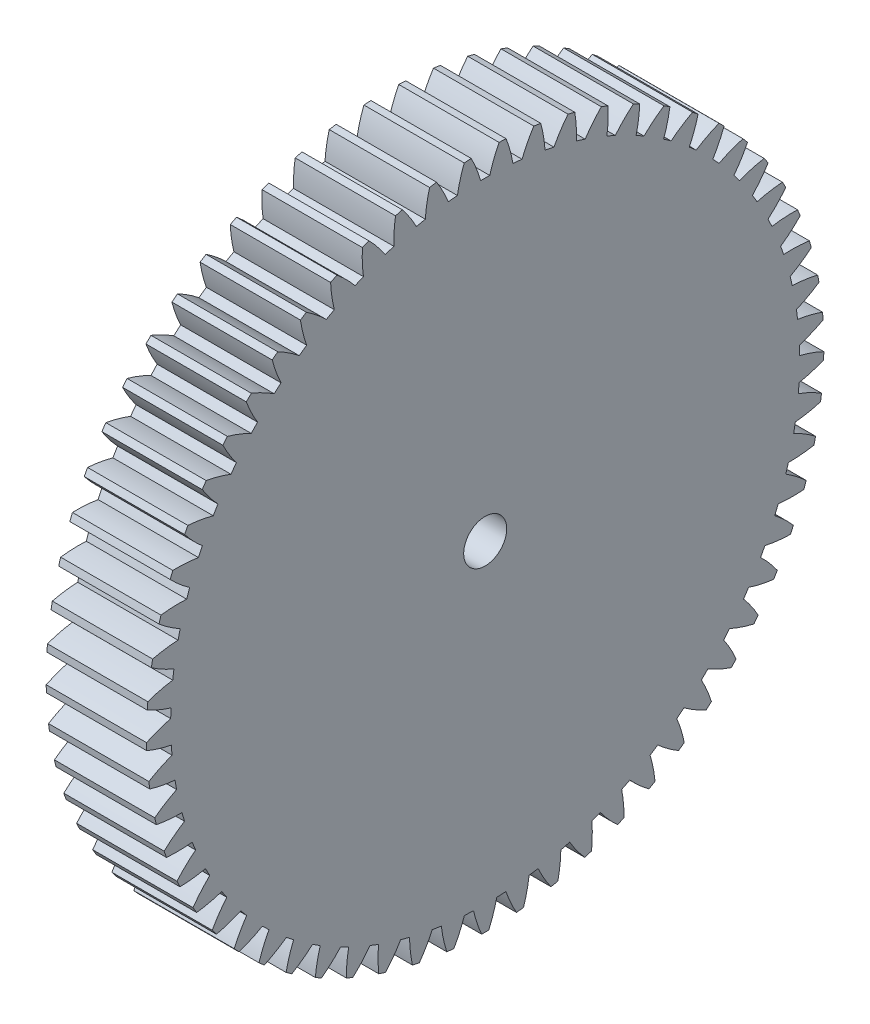
from build123d import *

# Parameters (mm, degrees)
BASPROSKE_W     = 14
BASPROSKE_H     = 47.25
TOOTHCUT_DEPTH  = 69.272432211
TEETHCUTS_COUNT = 61
TEETHCUTS_ANGLE = 354.098360656
BORSKE_R        = 3
BORE_DEPTH      = 50.0000508


with BuildPart() as part:
    # BasProSke → Base-Revolve (revolve)
    with BuildSketch(Plane(origin=(0, 0, 0), x_dir=(1, 0, 0), z_dir=(0, 1, 0)), mode=Mode.PRIVATE) as base_revolve_sk:
        with Locations((7, 23.625)):
            Rectangle(BASPROSKE_W, BASPROSKE_H)
    revolve(base_revolve_sk.sketch.rotate(Axis((-10, 0, 0), (1, 0, 0)), 180), axis=Axis((-10, 0, 0), (1, 0, 0)))

    # TooCutSke → ToothCut (cut, through all)
    with BuildSketch(Plane(origin=(0, 0, 0), x_dir=(0, 0, -1), z_dir=(1, 0, 0))):
        with BuildLine():
            ThreePointArc((0.637720624, 43.869365033), (0, 43.874), (-0.637720624, 43.869365033))
            ThreePointArc((-0.637720624, 43.869365033), (-1.212275139, 45.584750655), (-1.953389755, 47.235026343))
            ThreePointArc((-1.953389755, 47.235026343), (0, 47.2754), (1.953389755, 47.235026343))
            ThreePointArc((1.953389755, 47.235026343), (1.212275139, 45.584750655), (0.637720624, 43.869365033))
        make_face()
    toothcut = extrude(amount=TOOTHCUT_DEPTH, mode=Mode.SUBTRACT)

    # TeethCuts: ToothCut ×61 about axis
    teethcuts_axis = Axis((-10, 0, 0), (1, 0, 0))
    for i in range(1, TEETHCUTS_COUNT):
        add(toothcut.rotate(teethcuts_axis, i * TEETHCUTS_ANGLE / (TEETHCUTS_COUNT - 1)), mode=Mode.SUBTRACT)

    # BorSke → Bore (cut, symmetric)
    with BuildSketch(Plane(origin=(0, 0, 0), x_dir=(0, 0, -1), z_dir=(1, 0, 0))):
        with Locations(Location((0, 0, 0), (0, 0, 180))):
            Circle(BORSKE_R)
    extrude(amount=BORE_DEPTH, both=True, mode=Mode.SUBTRACT)


solid = part.part
